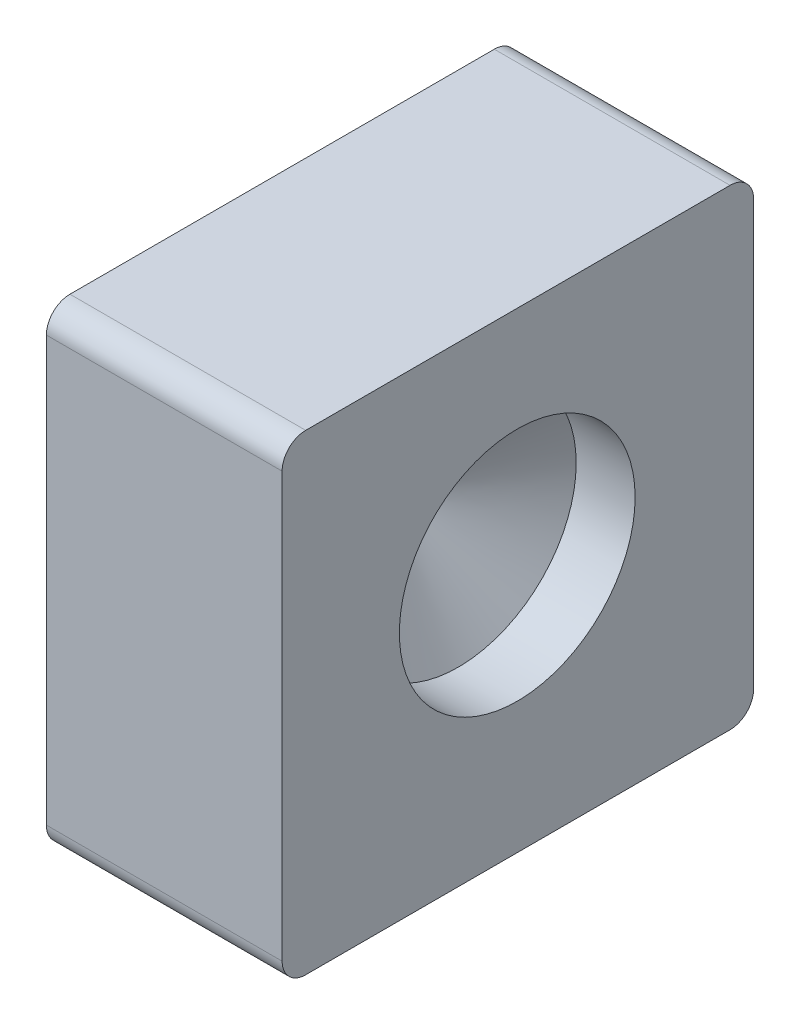
from build123d import *

# Parameters (mm, degrees)
BOSS_EXTRUDE1_DEPTH          = 25.4
F_1_1_0000_DOWEL_HOLE1_D     = 25.4
F_1_1_0000_DOWEL_HOLE1_DEPTH = 6.35
F_1_1_0000_DOWEL_HOLE1_TIP   = 7.630929862


with BuildPart() as part:
    # Sketch2 → Boss-Extrude1 (new body)
    with BuildSketch(Plane(origin=(0, 0, 0), x_dir=(0, 0, -1), z_dir=(1, 0, 0))):
        with BuildLine():
            Line((-25.20103811, 26.834337713), (20.51896189, 26.834337713))
            ThreePointArc((20.51896189, 26.834337713), (22.315013114, 26.090388938), (23.05896189, 24.294337713))
            Line((23.05896189, 24.294337713), (23.05896189, -21.425662287))
            ThreePointArc((23.05896189, -21.425662287), (22.315013114, -23.221713511), (20.51896189, -23.965662287))
            Line((20.51896189, -23.965662287), (-25.20103811, -23.965662287))
            ThreePointArc((-25.20103811, -23.965662287), (-26.997089334, -23.221713511), (-27.74103811, -21.425662287))
            Line((-27.74103811, -21.425662287), (-27.74103811, 24.294337713))
            ThreePointArc((-27.74103811, 24.294337713), (-26.997089334, 26.090388938), (-25.20103811, 26.834337713))
        make_face()
    extrude(amount=BOSS_EXTRUDE1_DEPTH)

    # 1 (1.0000) Dowel Hole1
    with Locations(Plane(origin=(25.4, 0, 0), x_dir=(0, 0, -1), z_dir=(1, 0, 0))):
        with Locations((-2.40903604, 2.862294249)):
            Hole(F_1_1_0000_DOWEL_HOLE1_D / 2, depth=F_1_1_0000_DOWEL_HOLE1_DEPTH)
            with Locations((0, 0, -(F_1_1_0000_DOWEL_HOLE1_DEPTH + F_1_1_0000_DOWEL_HOLE1_TIP / 2))):  # 118° drill point
                Cone(0, F_1_1_0000_DOWEL_HOLE1_D / 2, F_1_1_0000_DOWEL_HOLE1_TIP, mode=Mode.SUBTRACT)


solid = part.part
